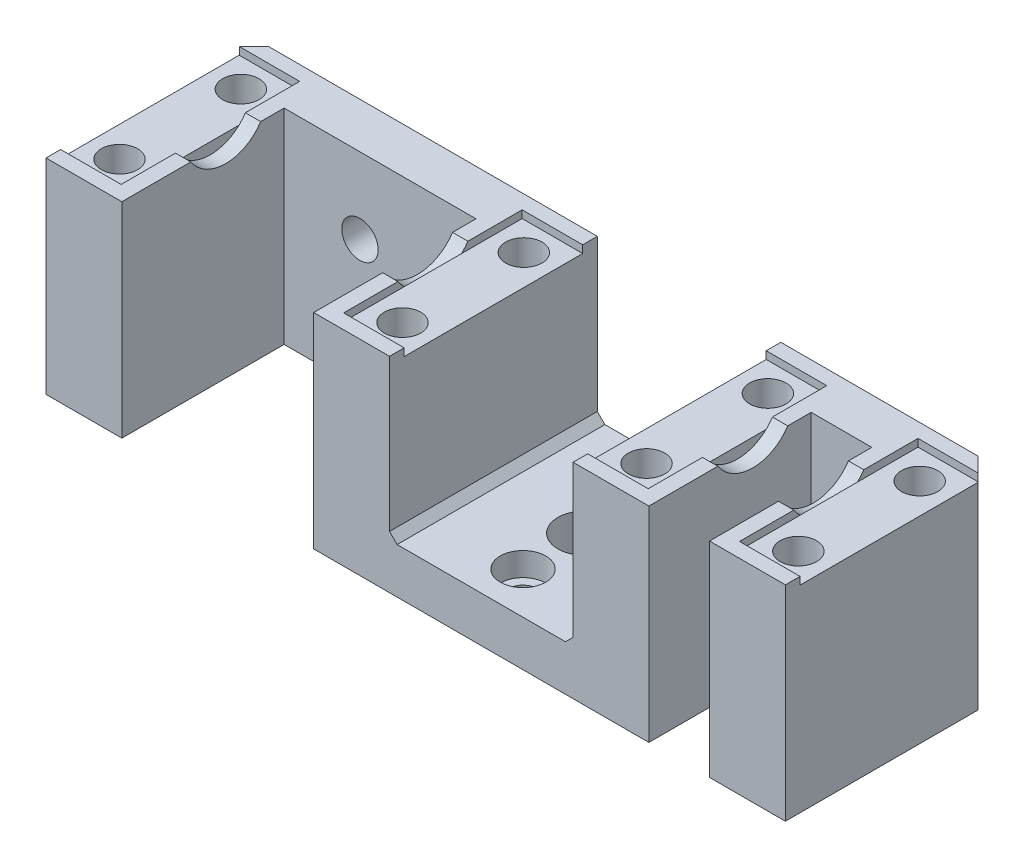
from build123d import *

# Parameters (mm, degrees)
SKETCH_2_W                = 97.5
SKETCH_2_H                = 27.4
EXTRUDE_1_DEPTH           = 6
SKETCH_3_W                = 10
SKETCH_3_H                = 27.4
EXTRUDE_2_DEPTH           = 21
SKETCH_5_W                = 7.98
SKETCH_5_H                = 23.54
CUT_EXTRUDE_1_DEPTH       = 1
SKETCH_7_R                = 1.7
CUT_EXTRUDE_2_DEPTH       = 57.923215826
SKETCH_8_R                = 3.6
SKETCH_8_R_2              = 1.8
CUT_EXTRUDE_3_DEPTH       = 55.820183327
CHAMFER_1_SIZE            = 2
SKETCH_13_W               = 8
SKETCH_13_H               = 6
SKETCH_13_W_2             = 25.3
EXTRUDE_3_DEPTH           = 21
SKETCH_14_R               = 2.4
CUT_EXTRUDE_9_DEPTH       = 10
SKETCH_15_W               = 25.3
SKETCH_15_H               = 21.4
SKETCH_15_W_2             = 8
CUT_EXTRUDE_10_DEPTH      = 10
SKETCH_16_R               = 3
CUT_EXTRUDE_11_DEPTH      = 3.1
SKETCH_17_R               = 2.4
CUT_EXTRUDE_12_DEPTH      = 4.1
CUT_EXTRUDE_13_DEPTH      = 10.02
CUT_EXTRUDE_13_DEPTH_BACK = 2.02
SKETCH_18_R               = 5.5
CUT_EXTRUDE_15_DEPTH      = 27.32
CUT_EXTRUDE_15_DEPTH_BACK = 2.02
SKETCH_20_R               = 5.5
CHAMFER_2_SIZE            = 1
SKETCH_21_R               = 1.7
SKETCH_21_R_2             = 1.549701769
EXTRUDE_4_DEPTH           = 21.9


with BuildPart() as part:
    # ｽｹｯﾁ2 → ﾎﾞｽ - 押し出し1 (new body)
    with BuildSketch(Plane(origin=(0, 0, 0), x_dir=(1, 0, 0), z_dir=(0, 1, 0))):
        Rectangle(SKETCH_2_W, SKETCH_2_H)
    extrude(amount=EXTRUDE_1_DEPTH)

    # ｽｹｯﾁ3 → ﾎﾞｽ - 押し出し2 (add)
    with BuildSketch(Plane(origin=(0, 6, 0), x_dir=(1, 0, 0), z_dir=(0, 1, 0))):
        with Locations((-43.75, 0)):
            Rectangle(SKETCH_3_W, SKETCH_3_H)
        with Locations((43.75, 0)):
            Rectangle(SKETCH_3_W, SKETCH_3_H)
        with Locations((-8.45, 0)):
            Rectangle(SKETCH_3_W, SKETCH_3_H)
        with Locations((25.75, 0)):
            Rectangle(SKETCH_3_W, SKETCH_3_H)
    extrude(amount=EXTRUDE_2_DEPTH)

    # ｽｹｯﾁ5 → ｶｯﾄ - 押し出し1 (cut)
    with BuildSketch(Plane(origin=(0, 27, 0), x_dir=(1, 0, 0), z_dir=(0, 1, 0))):
        with Locations((-44.76, 0)):
            Rectangle(SKETCH_5_W, SKETCH_5_H)
        with Locations((-7.44, 0)):
            Rectangle(SKETCH_5_W, SKETCH_5_H)
        with Locations((24.74, 0)):
            Rectangle(SKETCH_5_W, SKETCH_5_H)
        with Locations((44.76, 0)):
            Rectangle(SKETCH_5_W, SKETCH_5_H)
    extrude(amount=-CUT_EXTRUDE_1_DEPTH, mode=Mode.SUBTRACT)

    # ｽｹｯﾁ7 → ｶｯﾄ - 押し出し2 (cut, through all)
    with BuildSketch(Plane(origin=(0, 26, 0), x_dir=(1, 0, 0), z_dir=(0, 1, 0))):
        with Locations(Location((-44.76, 8, 0), (0, 0, 270))):
            Circle(SKETCH_7_R)
        with Locations(Location((-44.76, -8, 0), (0, 0, 270))):
            Circle(SKETCH_7_R)
        with Locations(Location((-7.44, 8, 0), (0, 0, 270))):
            Circle(SKETCH_7_R)
        with Locations(Location((-7.44, -8, 0), (0, 0, 270))):
            Circle(SKETCH_7_R)
        with Locations(Location((24.74, 8, 0), (0, 0, 270))):
            Circle(SKETCH_7_R)
        with Locations(Location((24.74, -8, 0), (0, 0, 270))):
            Circle(SKETCH_7_R)
        with Locations(Location((44.76, 8, 0), (0, 0, 270))):
            Circle(SKETCH_7_R)
        with Locations(Location((44.76, -8, 0), (0, 0, 270))):
            Circle(SKETCH_7_R)
    extrude(amount=-CUT_EXTRUDE_2_DEPTH, mode=Mode.SUBTRACT)

    # ｽｹｯﾁ8 → ｶｯﾄ - 押し出し3 (cut, through all)
    with BuildSketch(Plane(origin=(0, 6, 0), x_dir=(1, 0, 0), z_dir=(0, 1, 0))):
        with Locations(Location((8.65, 0, 0), (0, 0, 270))):
            Circle(SKETCH_8_R)
        with Locations(Location((8.65, 8.2, 0), (0, 0, 270))):
            Circle(SKETCH_8_R_2)
        with Locations(Location((8.65, -8.2, 0), (0, 0, 270))):
            Circle(SKETCH_8_R_2)
    extrude(amount=-CUT_EXTRUDE_3_DEPTH, mode=Mode.SUBTRACT)

    # 面取り1
    chamfer_1_edges = [part.edges().sort_by_distance(p)[0] for p in [
        (48.75, 13.5, -13.7),
        (-48.75, 13.5, -13.7),
    ]]
    chamfer(chamfer_1_edges, length=CHAMFER_1_SIZE)

    # ｽｹｯﾁ13 → ﾎﾞｽ - 押し出し3 (add)
    with BuildSketch(Plane(origin=(0, 6, 0), x_dir=(1, 0, 0), z_dir=(0, 1, 0))):
        with Locations((34.75, 10.7)):
            Rectangle(SKETCH_13_W, SKETCH_13_H)
        with Locations((-26.1, 10.7)):
            Rectangle(SKETCH_13_W_2, SKETCH_13_H)
    extrude(amount=EXTRUDE_3_DEPTH)

    # ｽｹｯﾁ14 → ｶｯﾄ - 押し出し9 (cut)
    with BuildSketch(Plane.XY.offset(-7.7)):
        with Locations((-28.75, 17)):
            Circle(SKETCH_14_R)
        with Locations((34.75, 17)):
            Circle(SKETCH_14_R)
    extrude(amount=-CUT_EXTRUDE_9_DEPTH, mode=Mode.SUBTRACT)

    # ｽｹｯﾁ15 → ｶｯﾄ - 押し出し10 (cut)
    with BuildSketch(Plane(origin=(0, 6, 0), x_dir=(1, 0, 0), z_dir=(0, 1, 0))):
        with Locations((-26.1, -3)):
            Rectangle(SKETCH_15_W, SKETCH_15_H)
        with Locations((34.75, -3)):
            Rectangle(SKETCH_15_W_2, SKETCH_15_H)
    extrude(amount=-CUT_EXTRUDE_10_DEPTH, mode=Mode.SUBTRACT)

    # ｽｹｯﾁ16 → ｶｯﾄ - 押し出し11 (cut)
    with BuildSketch(Plane(origin=(0, 6, 0), x_dir=(1, 0, 0), z_dir=(0, 1, 0))):
        with Locations(Location((8.65, 8.2, 0), (0, 0, 270))):
            Circle(SKETCH_16_R)
        with Locations(Location((8.65, -8.2, 0), (0, 0, 270))):
            Circle(SKETCH_16_R)
    extrude(amount=-CUT_EXTRUDE_11_DEPTH, mode=Mode.SUBTRACT)

    # ｽｹｯﾁ17 → ｶｯﾄ - 押し出し12 (cut)
    with BuildSketch(Plane(origin=(0, 26, 0), x_dir=(1, 0, 0), z_dir=(0, 1, 0))):
        with Locations(Location((-44.76, 8, 0), (0, 0, 270))):
            Circle(SKETCH_17_R)
        with Locations(Location((-44.76, -8, 0), (0, 0, 270))):
            Circle(SKETCH_17_R)
        with Locations(Location((-7.44, 8, 0), (0, 0, 270))):
            Circle(SKETCH_17_R)
        with Locations(Location((-7.44, -8, 0), (0, 0, 270))):
            Circle(SKETCH_17_R)
        with Locations(Location((24.74, 8, 0), (0, 0, 270))):
            Circle(SKETCH_17_R)
        with Locations(Location((24.74, -8, 0), (0, 0, 270))):
            Circle(SKETCH_17_R)
        with Locations(Location((44.76, 8, 0), (0, 0, 270))):
            Circle(SKETCH_17_R)
        with Locations(Location((44.76, -8, 0), (0, 0, 270))):
            Circle(SKETCH_17_R)
    extrude(amount=-CUT_EXTRUDE_12_DEPTH, mode=Mode.SUBTRACT)

    # ｽｹｯﾁ18 → ｶｯﾄ - 押し出し13 (cut, two sides: drawn at the far end of the back side and taken through both)
    with BuildSketch(Plane.ZY.offset(-38.75).offset(-CUT_EXTRUDE_13_DEPTH_BACK)):
        with Locations((0, 30)):
            Circle(SKETCH_18_R)
    extrude(amount=CUT_EXTRUDE_13_DEPTH + CUT_EXTRUDE_13_DEPTH_BACK, mode=Mode.SUBTRACT)

    # ｽｹｯﾁ20 → ｶｯﾄ - 押し出し15 (cut, two sides: drawn at the far end of the back side and taken through both)
    with BuildSketch(Plane(origin=(-38.75, 0, 0), x_dir=(0, 0, -1), z_dir=(1, 0, 0)).offset(-CUT_EXTRUDE_15_DEPTH_BACK)):
        with Locations((0, 30)):
            Circle(SKETCH_20_R)
    extrude(amount=CUT_EXTRUDE_15_DEPTH + CUT_EXTRUDE_15_DEPTH_BACK, mode=Mode.SUBTRACT)

    # 面取り2
    chamfer_2_edges = [part.edges().sort_by_distance(p)[0] for p in [
        (20.75, 6, 0),
        (-3.45, 6, 0),
    ]]
    chamfer(chamfer_2_edges, length=CHAMFER_2_SIZE)

    # ｽｹｯﾁ21 → ﾎﾞｽ - 押し出し4 (add)
    with BuildSketch(Plane(origin=(0, 21.9, 0), x_dir=(1, 0, 0), z_dir=(0, 1, 0))):
        with Locations((-7.44, 8)):
            Circle(SKETCH_21_R)
        with Locations((-44.76, 8)):
            Circle(SKETCH_21_R)
        with Locations(Location((24.74, 8, 0), (0, 0, 270))):
            Circle(SKETCH_21_R_2)
        with Locations((-44.76, -8)):
            Circle(SKETCH_21_R)
        with Locations((-7.44, -8)):
            Circle(SKETCH_21_R)
        with Locations((24.74, -8)):
            Circle(SKETCH_21_R)
        with Locations((44.76, 8)):
            Circle(SKETCH_21_R)
        with Locations((44.76, -8)):
            Circle(SKETCH_21_R)
    extrude(amount=-EXTRUDE_4_DEPTH)


with BuildPart() as extrude_4_piece_1:
    # of the separate pieces the step leaves, piece 1, a body of its own (extrude_4_pieces)
    add(part.part.solids().sort_by_distance((-3.45, 7, -13.7))[0])


with BuildPart() as extrude_4_piece_2:
    # of the separate pieces the step leaves, piece 2, a body of its own (extrude_4_pieces)
    add(part.part.solids().sort_by_distance((24.74, 21.9, -6.450298231))[0])


solid = Compound([extrude_4_piece_1.part, extrude_4_piece_2.part])
